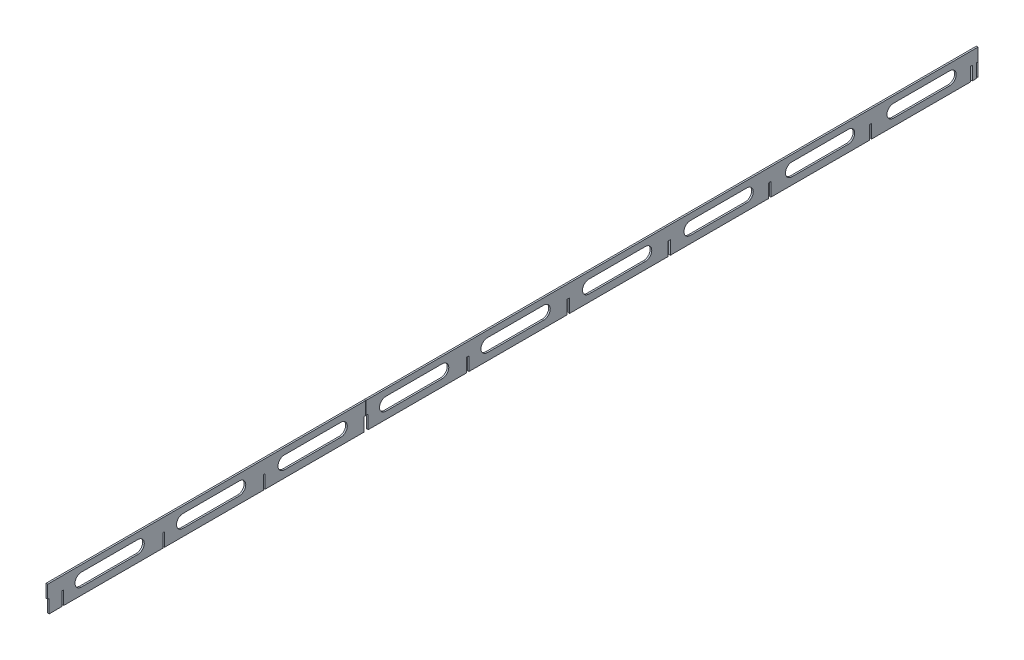
from build123d import *

# Parameters (mm, degrees)
SKETCH_1_W          = 2
SKETCH_1_H          = 32.905807398
EXTRUDE_1_DEPTH     = 1155
SKETCH_2_W          = 1.99
SKETCH_2_H          = 16.828171787
SKETCH_2_W_2        = 2
SKETCH_2_W_3        = 2.99
CUT_EXTRUDE_1_DEPTH = 3


with BuildPart() as part:
    # 草图1 → 凸台-拉伸1 (new body)
    with BuildSketch(Plane.XY):
        with Locations((-45.125456821, 5.194351007)):
            Rectangle(SKETCH_1_W, SKETCH_1_H)
    extrude(amount=EXTRUDE_1_DEPTH)

    # 草图2 → 切除-拉伸1 (cut)
    with BuildSketch(Plane.ZY.offset(46.125456821)):
        with Locations((1.005, -2.844466799)):
            Rectangle(SKETCH_2_W, SKETCH_2_H)
        with Locations((8.01, -2.844466799)):
            Rectangle(SKETCH_2_W_2, SKETCH_2_H)
        with BuildLine():
            Line((35, -2.352745294), (105, -2.352745294))
            ThreePointArc((105, -2.352745294), (113, 5.647254706), (105, 13.647254706))
            Line((105, 13.647254706), (35, 13.647254706))
            ThreePointArc((35, 13.647254706), (27, 5.647254706), (35, -2.352745294))
        make_face()
        with Locations((133.505, -2.844466799)):
            Rectangle(SKETCH_2_W_3, SKETCH_2_H)
        with BuildLine():
            Line((161, -2.352745294), (231, -2.352745294))
            ThreePointArc((231, -2.352745294), (239, 5.647254706), (231, 13.647254706))
            Line((231, 13.647254706), (161, 13.647254706))
            ThreePointArc((161, 13.647254706), (153, 5.647254706), (161, -2.352745294))
        make_face()
        with Locations((258.505, -2.844466799)):
            Rectangle(SKETCH_2_W_3, SKETCH_2_H)
        with BuildLine():
            Line((287, -2.352745294), (357, -2.352745294))
            ThreePointArc((357, -2.352745294), (365, 5.647254706), (357, 13.647254706))
            Line((357, 13.647254706), (287, 13.647254706))
            ThreePointArc((287, 13.647254706), (279, 5.647254706), (287, -2.352745294))
        make_face()
        with Locations((383.505, -2.844466799)):
            Rectangle(SKETCH_2_W_3, SKETCH_2_H)
        with BuildLine():
            Line((413, -2.352745294), (483, -2.352745294))
            ThreePointArc((483, -2.352745294), (491, 5.647254706), (483, 13.647254706))
            Line((483, 13.647254706), (413, 13.647254706))
            ThreePointArc((413, 13.647254706), (405, 5.647254706), (413, -2.352745294))
        make_face()
        with Locations((508.505, -2.844466799)):
            Rectangle(SKETCH_2_W_3, SKETCH_2_H)
        with BuildLine():
            Line((539, -2.352745294), (609, -2.352745294))
            ThreePointArc((609, -2.352745294), (617, 5.647254706), (609, 13.647254706))
            Line((609, 13.647254706), (539, 13.647254706))
            ThreePointArc((539, 13.647254706), (531, 5.647254706), (539, -2.352745294))
        make_face()
        with Locations((633.505, -2.844466799)):
            Rectangle(SKETCH_2_W_3, SKETCH_2_H)
        with BuildLine():
            Line((665, -2.352745294), (735, -2.352745294))
            ThreePointArc((735, -2.352745294), (743, 5.647254706), (735, 13.647254706))
            Line((735, 13.647254706), (665, 13.647254706))
            ThreePointArc((665, 13.647254706), (657, 5.647254706), (665, -2.352745294))
        make_face()
        Polygon((757.01, 5.569619095), (757.01, -11.258552692), (760, -11.258552692), (760, 5.569619095), (759.9, 5.569619095), align=None)
        Polygon((760, 5.569619095), (760, -11.258552692), (762, -11.258552692), (762, 5.569619095), (760.1, 5.569619095), align=None)
        Polygon((759.9, 21.647254706), (759.9, 5.569619095), (760, 5.569619095), (760.1, 5.569619095), (760.1, 21.647254706), align=None)
        with BuildLine():
            Line((791, -2.352745294), (861, -2.352745294))
            ThreePointArc((861, -2.352745294), (869, 5.647254706), (861, 13.647254706))
            Line((861, 13.647254706), (791, 13.647254706))
            ThreePointArc((791, 13.647254706), (783, 5.647254706), (791, -2.352745294))
        make_face()
        with Locations((886, -2.844466799)):
            Rectangle(SKETCH_2_W_2, SKETCH_2_H)
        with BuildLine():
            Line((917, -2.352745294), (987, -2.352745294))
            ThreePointArc((987, -2.352745294), (995, 5.647254706), (987, 13.647254706))
            Line((987, 13.647254706), (917, 13.647254706))
            ThreePointArc((917, 13.647254706), (909, 5.647254706), (917, -2.352745294))
        make_face()
        with Locations((1011, -2.844466799)):
            Rectangle(SKETCH_2_W_2, SKETCH_2_H)
        with BuildLine():
            Line((1043, -2.352745294), (1113, -2.352745294))
            ThreePointArc((1113, -2.352745294), (1121, 5.647254706), (1113, 13.647254706))
            Line((1113, 13.647254706), (1043, 13.647254706))
            ThreePointArc((1043, 13.647254706), (1035, 5.647254706), (1043, -2.352745294))
        make_face()
        with Locations((1136, -2.844466799)):
            Rectangle(SKETCH_2_W_2, SKETCH_2_H)
        with Locations((1154, -2.844466799)):
            Rectangle(SKETCH_2_W_2, SKETCH_2_H)
    extrude(amount=-CUT_EXTRUDE_1_DEPTH, mode=Mode.SUBTRACT)


with BuildPart() as cut_extrude_1_piece_1:
    # of the separate pieces the step leaves, piece 1, a body of its own (cut_extrude_1_pieces)
    add(part.part.solids().sort_by_distance((-44.125456821, 21.647254706, 0))[0])


with BuildPart() as cut_extrude_1_piece_2:
    # of the separate pieces the step leaves, piece 2, a body of its own (cut_extrude_1_pieces)
    add(part.part.solids().sort_by_distance((-46.125456821, 21.647254706, 760.1))[0])


solid = Compound([cut_extrude_1_piece_1.part, cut_extrude_1_piece_2.part])
